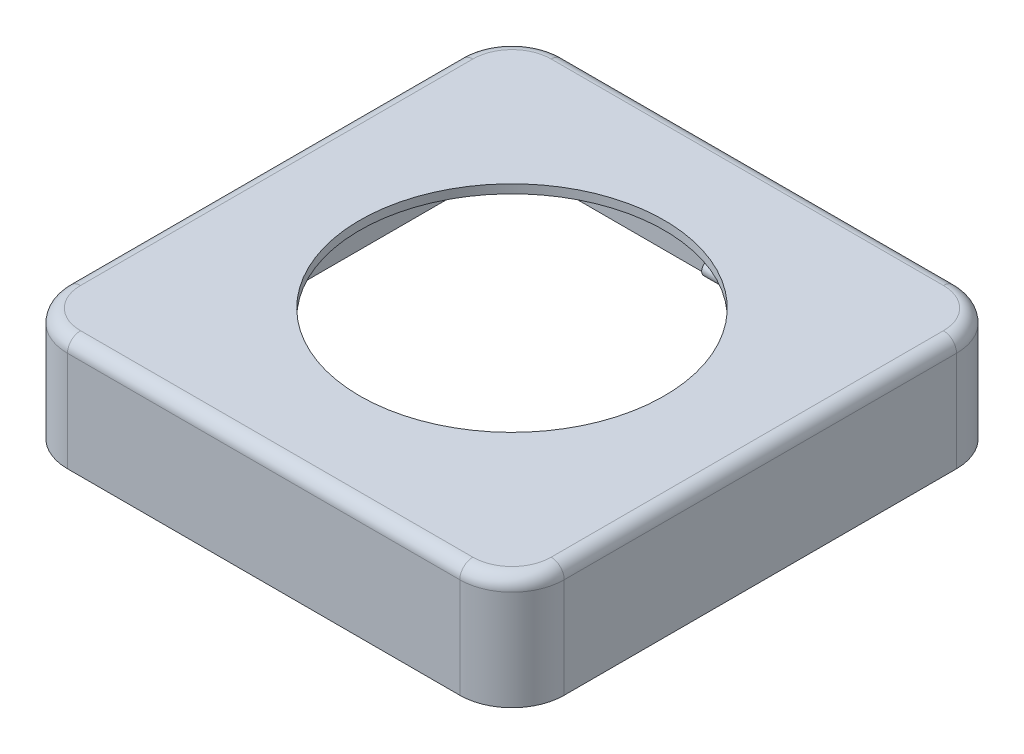
from build123d import *

# Parameters (mm, degrees)
BOSS_EXTRUDE1_DEPTH = 12
SKETCH2_R           = 17.5
BOSS_EXTRUDE2_DEPTH = 1
SKETCH3_R           = 0.75
BOSS_EXTRUDE3_DEPTH = 5
FILLET1_R           = 1.5
CUT_EXTRUDE6_REACH  = 67.15
SKETCH6_R           = 2.85
CHAMFER1_SIZE       = 0.5


with BuildPart() as part:
    # Sketch1 → Boss-Extrude1 (new body)
    with BuildSketch(Plane(origin=(0, 0, 0), x_dir=(1, 0, 0), z_dir=(0, 1, 0))):
        with BuildLine():
            Line((-28.55, 22.55), (-28.55, -22.55))
            ThreePointArc((-28.55, -22.55), (-26.792640687, -26.792640687), (-22.55, -28.55))
            Line((-22.55, -28.55), (22.55, -28.55))
            ThreePointArc((22.55, -28.55), (26.792640687, -26.792640687), (28.55, -22.55))
            Line((28.55, -22.55), (28.55, 22.55))
            ThreePointArc((28.55, 22.55), (26.792640687, 26.792640687), (22.55, 28.55))
            Line((22.55, 28.55), (-22.55, 28.55))
            ThreePointArc((-22.55, 28.55), (-26.792640687, 26.792640687), (-28.55, 22.55))
        make_face()
        with BuildLine():
            Line((-22.55, 27.55), (22.55, 27.55))
            ThreePointArc((22.55, 27.55), (26.085533906, 26.085533906), (27.55, 22.55))
            Line((27.55, 22.55), (27.55, -22.55))
            ThreePointArc((27.55, -22.55), (26.085533906, -26.085533906), (22.55, -27.55))
            Line((22.55, -27.55), (-22.55, -27.55))
            ThreePointArc((-22.55, -27.55), (-26.085533906, -26.085533906), (-27.55, -22.55))
            Line((-27.55, -22.55), (-27.55, 22.55))
            ThreePointArc((-27.55, 22.55), (-26.085533906, 26.085533906), (-22.55, 27.55))
        make_face(mode=Mode.SUBTRACT)
    extrude(amount=BOSS_EXTRUDE1_DEPTH)

    # Sketch2 → Boss-Extrude2 (add)
    with BuildSketch(Plane(origin=(0, 12, 0), x_dir=(1, 0, 0), z_dir=(0, 1, 0))):
        with BuildLine():
            Line((-22.55, -28.55), (22.55, -28.55))
            ThreePointArc((22.55, -28.55), (26.792640687, -26.792640687), (28.55, -22.55))
            Line((28.55, -22.55), (28.55, 22.55))
            ThreePointArc((28.55, 22.55), (26.792640687, 26.792640687), (22.55, 28.55))
            Line((22.55, 28.55), (-22.55, 28.55))
            ThreePointArc((-22.55, 28.55), (-26.792640687, 26.792640687), (-28.55, 22.55))
            Line((-28.55, 22.55), (-28.55, -22.55))
            ThreePointArc((-28.55, -22.55), (-26.792640687, -26.792640687), (-22.55, -28.55))
        make_face()
        with Locations(Location((0, 0, 0), (0, 0, 270))):
            Circle(SKETCH2_R, mode=Mode.SUBTRACT)
    extrude(amount=BOSS_EXTRUDE2_DEPTH)

    # Sketch3 → Boss-Extrude3 (add, symmetric)
    with BuildSketch(Plane.ZY):
        with Locations((-27.55, 0.75)):
            Circle(SKETCH3_R)
        with Locations((27.55, 0.75)):
            Circle(SKETCH3_R)
    extrude(amount=BOSS_EXTRUDE3_DEPTH, both=True)

    # Fillet1
    fillet1_edges = [part.edges().sort_by_distance(p)[0] for p in [
        (-26.792640687, 13, 26.792640687),
        (0, 13, 28.55),
        (26.792640687, 13, 26.792640687),
        (28.55, 13, 0),
        (26.792640687, 13, -26.792640687),
        (0, 13, -28.55),
        (-26.792640687, 13, -26.792640687),
        (-28.55, 13, 0),
    ]]
    fillet(fillet1_edges, radius=FILLET1_R)

    # Sketch6 → Cut-Extrude6 (cut, up to next)
    with BuildSketch(Plane.ZY.offset(28.55), mode=Mode.PRIVATE) as cut_extrude6_sk1:
        with Locations((-12.78, 7.73)):
            Circle(SKETCH6_R)
    cut_extrude6_tool1 = extrude(cut_extrude6_sk1.sketch, amount=-CUT_EXTRUDE6_REACH, mode=Mode.PRIVATE) & part.part
    # Sketch6 → Cut-Extrude6 (cut, up to next)
    with BuildSketch(Plane.ZY.offset(28.55), mode=Mode.PRIVATE) as cut_extrude6_sk2:
        with BuildLine():
            Line((-3.19, 3.82), (3.189999856, 3.82))
            ThreePointArc((3.189999856, 3.82), (4.236517943, 4.253481955), (4.67, 5.3))
            Line((4.67, 5.3), (4.67, 5.9))
            ThreePointArc((4.67, 5.9), (4.236518036, 6.946518036), (3.19, 7.38))
            Line((3.19, 7.38), (-3.19, 7.38))
            ThreePointArc((-3.19, 7.38), (-4.236518036, 6.946518036), (-4.67, 5.9))
            Line((-4.67, 5.9), (-4.67, 5.3))
            ThreePointArc((-4.67, 5.3), (-4.236518036, 4.253481964), (-3.19, 3.82))
        make_face()
    cut_extrude6_tool2 = extrude(cut_extrude6_sk2.sketch, amount=-CUT_EXTRUDE6_REACH, mode=Mode.PRIVATE) & part.part
    add(cut_extrude6_tool1.solids().sort_by_distance((-28.55, 7.73, -12.78))[0], mode=Mode.SUBTRACT)
    add(cut_extrude6_tool2.solids().sort_by_distance((-28.55, 5.6, 0))[0], mode=Mode.SUBTRACT)

    # Chamfer1
    chamfer1_edges = [part.edges().sort_by_distance(p)[0] for p in [
        (-28.55, 4.253481964, -4.236518036),
        (-28.55, 3.82, -7.2e-08),
        (-28.55, 4.253481955, 4.236517943),
        (-28.55, 5.6, 4.67),
        (-28.55, 6.946518036, 4.236518036),
        (-28.55, 7.38, 0),
        (-28.55, 6.946518036, -4.236518036),
        (-28.55, 5.6, -4.67),
        (-28.55, 7.73, -15.63),
    ]]
    chamfer(chamfer1_edges, length=CHAMFER1_SIZE)


solid = part.part
